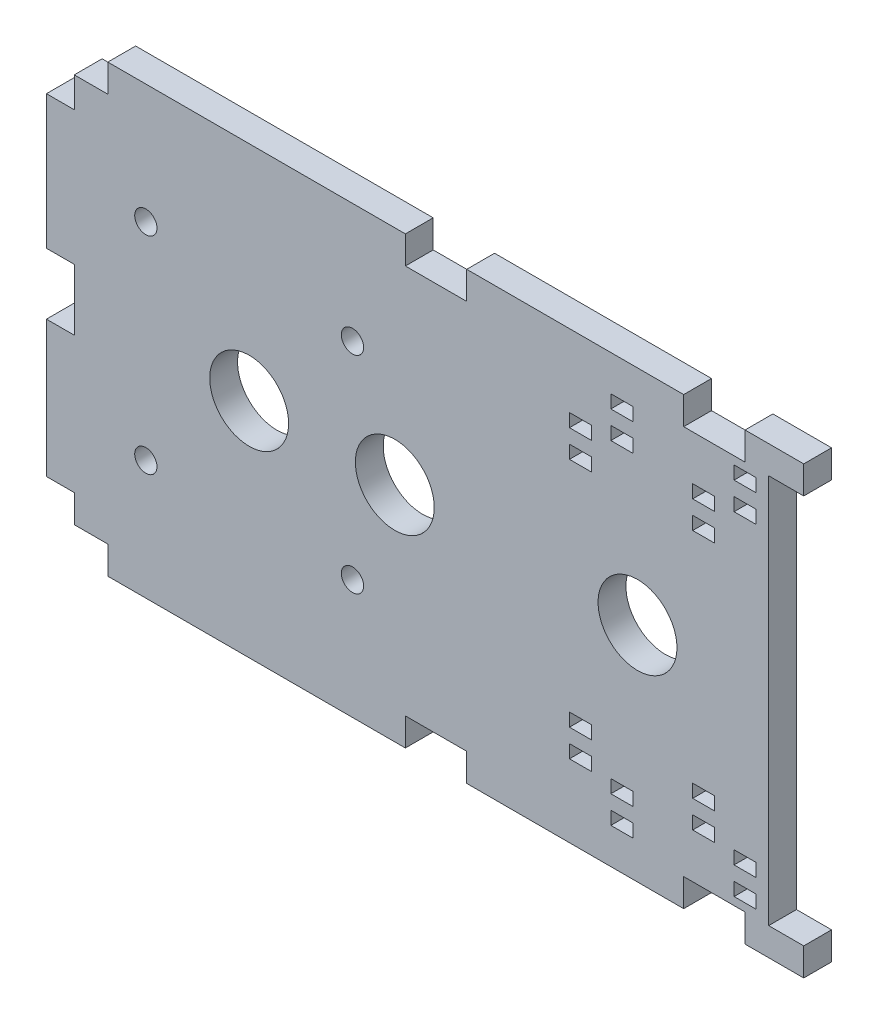
from build123d import *

# Parameters (mm, degrees)
SKETCH2_W           = 177.8
SKETCH2_H           = 101.6
BOSS_EXTRUDE3_DEPTH = 6.35
SKETCH3_R           = 9
SKETCH3_R_2         = 2.54
CUT_EXTRUDE1_DEPTH  = 103.587389576
SKETCH7_W           = 6.35
SKETCH7_H           = 14
SKETCH7_W_2         = 14
SKETCH7_H_2         = 6.35
CUT_EXTRUDE2_DEPTH  = 103.587389576
SKETCH9_W           = 5
SKETCH9_H           = 3
CUT_EXTRUDE3_DEPTH  = 103.587389576


with BuildPart() as part:
    # Sketch2 → Boss-Extrude3 (new body)
    with BuildSketch(Plane.XY):
        Rectangle(SKETCH2_W, SKETCH2_H)
    extrude(amount=BOSS_EXTRUDE3_DEPTH)

    # Sketch3 → Cut-Extrude1 (cut, through all)
    with BuildSketch(Plane.XY.offset(6.35)):
        with Locations((-9.4120506, 0)):
            Circle(SKETCH3_R)
        with Locations((-42.64375, 0)):
            Circle(SKETCH3_R)
        with Locations((-66.216922318, 23.573172318)):
            Circle(SKETCH3_R_2)
        with Locations((-19.070577682, 23.573172318)):
            Circle(SKETCH3_R_2)
        with Locations((-66.216922318, -23.573172318)):
            Circle(SKETCH3_R_2)
        with Locations((-19.070577682, -23.573172318)):
            Circle(SKETCH3_R_2)
        with Locations((45.9739194, 0)):
            Circle(SKETCH3_R)
    extrude(amount=-CUT_EXTRUDE1_DEPTH, mode=Mode.SUBTRACT)

    # Sketch7 → Cut-Extrude2 (cut, through all)
    with BuildSketch(Plane.XY.offset(6.35)):
        with Locations((-85.725, 0)):
            Rectangle(SKETCH7_W, SKETCH7_H)
        Polygon((-74.9, 50.8), (-88.9, 50.8), (-88.9, 37.554527849), (-82.55, 37.554527849), (-82.55, 44.45), (-74.9, 44.45), align=None)
        Polygon((-88.9, -38.1), (-88.9, -50.8), (-74.9, -50.8), (-74.9, -44.45), (-82.55, -44.45), (-82.55, -38.1), align=None)
        with Locations((63.509, 47.625)):
            Rectangle(SKETCH7_W_2, SKETCH7_H_2)
        with Locations((0, 47.625)):
            Rectangle(SKETCH7_W_2, SKETCH7_H_2)
        Polygon((88.9, 50.8), (83.9, 50.8), (83.9, 44.45), (75.9, 44.45), (75.9, -44.45), (83.9, -44.45), (83.9, -50.8), (88.9, -50.8), align=None)
        with Locations((63.509, -47.625)):
            Rectangle(SKETCH7_W_2, SKETCH7_H_2)
        with Locations((0, -47.625)):
            Rectangle(SKETCH7_W_2, SKETCH7_H_2)
    extrude(amount=-CUT_EXTRUDE2_DEPTH, mode=Mode.SUBTRACT)

    # Sketch9 → Cut-Extrude3 (cut, through all)
    with BuildSketch(Plane.XY.offset(6.35)):
        with Locations((61.062890697, 32.715)):
            Rectangle(SKETCH9_W, SKETCH9_H)
        with Locations((32.943445348, 32.715)):
            Rectangle(SKETCH9_W, SKETCH9_H)
        with Locations((61.063445348, -26.465)):
            Rectangle(SKETCH9_W, SKETCH9_H)
        with Locations((61.063445348, -32.715)):
            Rectangle(SKETCH9_W, SKETCH9_H)
        with Locations((32.943445348, -26.465)):
            Rectangle(SKETCH9_W, SKETCH9_H)
        with Locations((32.943445348, -32.715)):
            Rectangle(SKETCH9_W, SKETCH9_H)
        with Locations((70.509, -41.147)):
            Rectangle(SKETCH9_W, SKETCH9_H)
        with Locations((70.508445348, 41.147)):
            Rectangle(SKETCH9_W, SKETCH9_H)
        with Locations((70.508445348, 34.897)):
            Rectangle(SKETCH9_W, SKETCH9_H)
        with Locations((42.388445348, 41.147)):
            Rectangle(SKETCH9_W, SKETCH9_H)
        with Locations((42.388445348, 34.897)):
            Rectangle(SKETCH9_W, SKETCH9_H)
        with Locations((42.388445348, -34.897)):
            Rectangle(SKETCH9_W, SKETCH9_H)
        with Locations((42.388445348, -41.147)):
            Rectangle(SKETCH9_W, SKETCH9_H)
        with Locations((61.062890697, 26.465)):
            Rectangle(SKETCH9_W, SKETCH9_H)
        with Locations((32.943445348, 26.465)):
            Rectangle(SKETCH9_W, SKETCH9_H)
        with Locations((70.509, -34.897)):
            Rectangle(SKETCH9_W, SKETCH9_H)
    extrude(amount=-CUT_EXTRUDE3_DEPTH, mode=Mode.SUBTRACT)


solid = part.part
